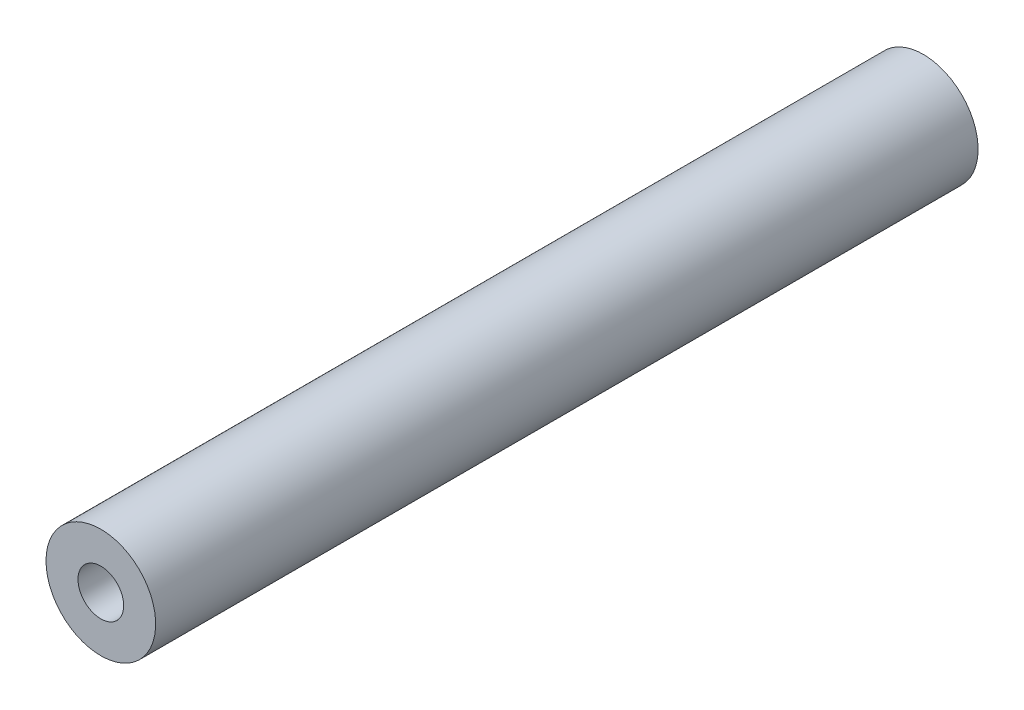
from build123d import *

# Parameters (mm, degrees)
ESBO_O1_R                                   = 3
RESSALTO_EXTRUS_O1_DEPTH                    = 45
BROCA_DE_ROSQUEAR_PARA_TARRAXA_DE_M31_D     = 2.5
BROCA_DE_ROSQUEAR_PARA_TARRAXA_DE_M31_DEPTH = 8
BROCA_DE_ROSQUEAR_PARA_TARRAXA_DE_M31_TIP   = 0.751075774
BROCA_DE_ROSQUEAR_PARA_TARRAXA_DE_M32_D     = 2.5
BROCA_DE_ROSQUEAR_PARA_TARRAXA_DE_M32_DEPTH = 8
BROCA_DE_ROSQUEAR_PARA_TARRAXA_DE_M32_TIP   = 0.751075774


with BuildPart() as part:
    # Esboço1 → Ressalto-extrusão1 (new body)
    with BuildSketch(Plane.XY):
        with Locations(Location((0, 0, 0), (0, 0, 180))):
            Circle(ESBO_O1_R)
    extrude(amount=RESSALTO_EXTRUS_O1_DEPTH)

    # Broca de rosquear para tarraxa de M31
    with Locations(Plane.XY.offset(45)):
        with Locations((0, 0)):
            Hole(BROCA_DE_ROSQUEAR_PARA_TARRAXA_DE_M31_D / 2, depth=BROCA_DE_ROSQUEAR_PARA_TARRAXA_DE_M31_DEPTH)
            with Locations((0, 0, -(BROCA_DE_ROSQUEAR_PARA_TARRAXA_DE_M31_DEPTH + BROCA_DE_ROSQUEAR_PARA_TARRAXA_DE_M31_TIP / 2))):  # 118° drill point
                Cone(0, BROCA_DE_ROSQUEAR_PARA_TARRAXA_DE_M31_D / 2, BROCA_DE_ROSQUEAR_PARA_TARRAXA_DE_M31_TIP, mode=Mode.SUBTRACT)

    # Broca de rosquear para tarraxa de M32
    with Locations(Plane(origin=(0, 0, 0), x_dir=(-1, 0, 0), z_dir=(0, 0, -1))):
        with Locations((0, 0)):
            Hole(BROCA_DE_ROSQUEAR_PARA_TARRAXA_DE_M32_D / 2, depth=BROCA_DE_ROSQUEAR_PARA_TARRAXA_DE_M32_DEPTH)
            with Locations((0, 0, -(BROCA_DE_ROSQUEAR_PARA_TARRAXA_DE_M32_DEPTH + BROCA_DE_ROSQUEAR_PARA_TARRAXA_DE_M32_TIP / 2))):  # 118° drill point
                Cone(0, BROCA_DE_ROSQUEAR_PARA_TARRAXA_DE_M32_D / 2, BROCA_DE_ROSQUEAR_PARA_TARRAXA_DE_M32_TIP, mode=Mode.SUBTRACT)


solid = part.part
